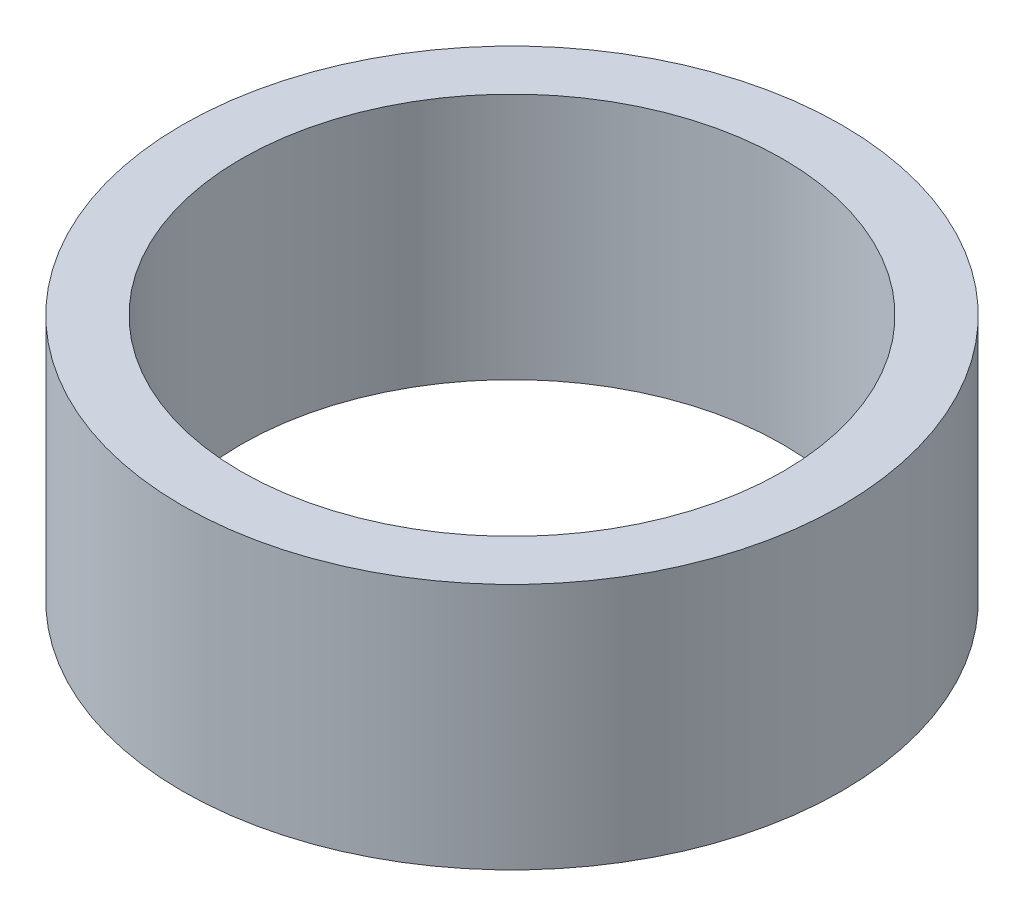
from build123d import *

# Parameters (mm, degrees)
SKETCH1_R           = 14
SKETCH1_R_2         = 11.5
BOSS_EXTRUDE1_DEPTH = 10.5


with BuildPart() as part:
    # Sketch1 → Boss-Extrude1 (new body)
    with BuildSketch(Plane(origin=(0, 0, 0), x_dir=(1, 0, 0), z_dir=(0, 1, 0))):
        with Locations(Location((0, 0, 0), (0, 0, 90))):
            Circle(SKETCH1_R)
        with Locations(Location((0, 0, 0), (0, 0, 90))):
            Circle(SKETCH1_R_2, mode=Mode.SUBTRACT)
    extrude(amount=BOSS_EXTRUDE1_DEPTH)


solid = part.part
